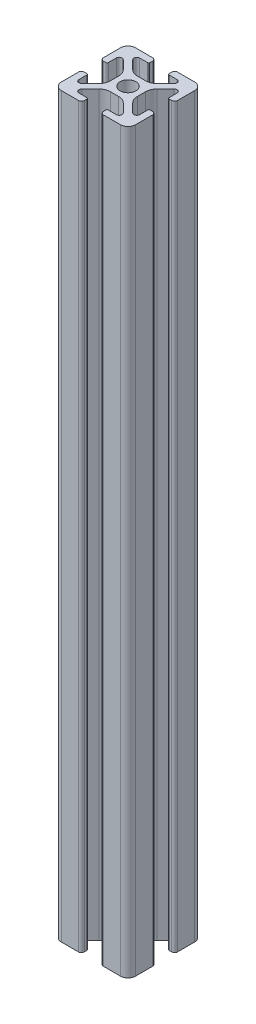
from build123d import *

# Parameters (mm, degrees)
SKETCH1_R           = 2.15
BOSS_EXTRUDE1_DEPTH = 199


with BuildPart() as part:
    # Sketch1 → Boss-Extrude1 (new body)
    with BuildSketch(Plane.XZ):
        with BuildLine():
            Line((-3.375, 10), (-8, 10))
            ThreePointArc((-8, 10), (-9.414213562, 9.414213562), (-10, 8))
            Line((-10, 8), (-10, 3.375))
            ThreePointArc((-10, 3.375), (-9.765685425, 2.809314575), (-9.2, 2.575))
            Line((-9.2, 2.575), (-8.500000763, 2.575))
            ThreePointArc((-8.500000763, 2.575), (-8.287868729, 2.662867966), (-8.200000763, 2.875))
            Line((-8.200000763, 2.875), (-8.200000763, 5.044121369))
            ThreePointArc((-8.200000763, 5.044121369), (-7.71849397, 5.76474735), (-6.868457672, 5.595664857))
            Line((-6.868457672, 5.595664857), (-4.528679789, 3.255888659))
            ThreePointArc((-4.528679789, 3.255888659), (-3.878360978, 2.282618348), (-3.649999368, 1.134567552))
            Line((-3.649999368, 1.134567552), (-3.649999368, -1.134567779))
            ThreePointArc((-3.649999368, -1.134567779), (-3.878360979, -2.282618579), (-4.528679795, -3.255888892))
            Line((-4.528679795, -3.255888892), (-6.868457674, -5.595665072))
            ThreePointArc((-6.868457674, -5.595665072), (-7.718493971, -5.764747564), (-8.200000763, -5.044121583))
            Line((-8.200000763, -5.044121583), (-8.200000763, -2.875))
            ThreePointArc((-8.200000763, -2.875), (-8.287868729, -2.662867966), (-8.500000763, -2.575))
            Line((-8.500000763, -2.575), (-9.2, -2.575))
            ThreePointArc((-9.2, -2.575), (-9.765685425, -2.809314575), (-10, -3.375))
            Line((-10, -3.375), (-10, -8))
            ThreePointArc((-10, -8), (-9.414213562, -9.414213562), (-8, -10))
            Line((-8, -10), (-3.375, -10))
            ThreePointArc((-3.375, -10), (-2.800759206, -9.762141675), (-2.562900881, -9.187900881))
            Line((-2.562900881, -9.187900881), (-2.562900881, -8.425196206))
            ThreePointArc((-2.562900881, -8.425196206), (-2.632402849, -8.257403612), (-2.800195443, -8.187901644))
            Line((-2.800195443, -8.187901644), (-5.049133208, -8.187901644))
            ThreePointArc((-5.049133208, -8.187901644), (-5.763211193, -7.710770081), (-5.595665074, -6.868457672))
            Line((-5.595665074, -6.868457672), (-3.255888886, -4.528679799))
            ThreePointArc((-3.255888886, -4.528679799), (-2.282618575, -3.878360987), (-1.134567778, -3.649999378))
            Line((-1.134567778, -3.649999378), (1.134573171, -3.649999378))
            ThreePointArc((1.134573171, -3.649999378), (2.282622968, -3.878360573), (3.25589275, -4.52867827))
            Line((3.25589275, -4.52867827), (5.595670922, -6.868454756))
            ThreePointArc((5.595670922, -6.868454756), (5.763217861, -7.710768912), (5.049138405, -8.187901644))
            Line((5.049138405, -8.187901644), (2.887098902, -8.187901644))
            ThreePointArc((2.887098902, -8.187901644), (2.666411499, -8.279313359), (2.574999783, -8.500000763))
            Line((2.574999783, -8.500000763), (2.574999783, -9.2))
            ThreePointArc((2.574999783, -9.2), (2.809314358, -9.765685425), (3.374999783, -10))
            Line((3.374999783, -10), (8, -10))
            ThreePointArc((8, -10), (9.414213562, -9.414213562), (10, -8))
            Line((10, -8), (10, -3.375))
            ThreePointArc((10, -3.375), (9.765685425, -2.809314575), (9.2, -2.575))
            Line((9.2, -2.575), (8.499995064, -2.575))
            ThreePointArc((8.499995064, -2.575), (8.28786303, -2.662867966), (8.199995064, -2.875))
            Line((8.199995064, -2.875), (8.199995064, -5.044124934))
            ThreePointArc((8.199995064, -5.044124934), (7.71848801, -5.764751024), (6.868451574, -5.595668024))
            Line((6.868451574, -5.595668024), (4.528675393, -3.255890143))
            ThreePointArc((4.528675393, -3.255890143), (3.878357701, -2.282620364), (3.649996507, -1.13457057))
            Line((3.649996507, -1.13457057), (3.649996507, 1.134570517))
            ThreePointArc((3.649996507, 1.134570517), (3.878357702, 2.282620314), (4.528675399, 3.255890096))
            Line((4.528675399, 3.255890096), (6.868450549, 5.595666932))
            ThreePointArc((6.868450549, 5.595666932), (7.71848764, 5.764750061), (8.199995064, 5.044123416))
            Line((8.199995064, 5.044123416), (8.199995064, 2.875))
            ThreePointArc((8.199995064, 2.875), (8.28786303, 2.662867966), (8.499995064, 2.575))
            Line((8.499995064, 2.575), (9.2, 2.575))
            ThreePointArc((9.2, 2.575), (9.765685425, 2.809314575), (10, 3.375))
            Line((10, 3.375), (10, 8))
            ThreePointArc((10, 8), (9.414213562, 9.414213562), (8, 10))
            Line((8, 10), (3.374999783, 10))
            ThreePointArc((3.374999783, 10), (2.809314358, 9.765685425), (2.574999783, 9.2))
            Line((2.574999783, 9.2), (2.574999783, 8.500000763))
            ThreePointArc((2.574999783, 8.500000763), (2.662867749, 8.287868729), (2.874999783, 8.200000763))
            Line((2.874999783, 8.200000763), (5.044126937, 8.200000763))
            ThreePointArc((5.044126937, 8.200000763), (5.764754441, 7.718492764), (5.595671108, 6.868454659))
            Line((5.595671108, 6.868454659), (3.255893005, 4.528678255))
            ThreePointArc((3.255893005, 4.528678255), (2.282623225, 3.878360562), (1.134573431, 3.649999368))
            Line((1.134573431, 3.649999368), (-1.134567779, 3.649999368))
            ThreePointArc((-1.134567779, 3.649999368), (-2.282618579, 3.878360979), (-3.255888892, 4.528679795))
            Line((-3.255888892, 4.528679795), (-5.595665072, 6.868457674))
            ThreePointArc((-5.595665072, 6.868457674), (-5.764747564, 7.718493971), (-5.044121583, 8.200000763))
            Line((-5.044121583, 8.200000763), (-2.875, 8.200000763))
            ThreePointArc((-2.875, 8.200000763), (-2.654312596, 8.291412479), (-2.562900881, 8.512099882))
            Line((-2.562900881, 8.512099882), (-2.562900881, 9.187900881))
            ThreePointArc((-2.562900881, 9.187900881), (-2.800759206, 9.762141675), (-3.375, 10))
        make_face()
        with Locations(Location((0, 0, 0), (0, 0, 90))):
            Circle(SKETCH1_R, mode=Mode.SUBTRACT)
    extrude(amount=-BOSS_EXTRUDE1_DEPTH)


solid = part.part
